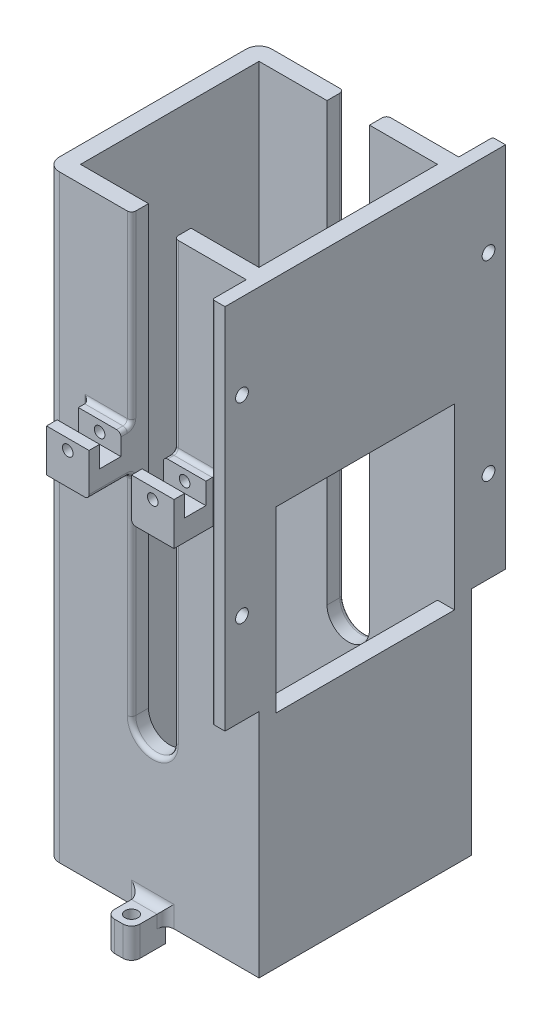
from build123d import *

# Parameters (mm, degrees)
SKETCH1_W                = 50
SKETCH1_H                = 50
SKETCH1_W_2              = 42
SKETCH1_H_2              = 42
BOSS_EXTRUDE1_DEPTH      = 140.8
CUT_EXTRUDE1_DEPTH       = 152.491385894
SKETCH5_W                = 10
SKETCH5_H                = 10
BOSS_EXTRUDE3_DEPTH      = 15
SKETCH8_W                = 10
SKETCH8_H                = 10
CUT_EXTRUDE4_DEPTH       = 107.56570743
SKETCH9_W                = 30
SKETCH9_H                = 5
CUT_EXTRUDE5_DEPTH       = 5
SKETCH10_R               = 1.25
CUT_EXTRUDE6_DEPTH       = 10
FILLET5_R                = 1
FILLET6_R                = 1
CUT_EXTRUDE3_REACH       = 155.459
SKETCH7_W                = 42
SKETCH7_H                = 42
SKETCH11_W               = 3
SKETCH11_H               = 86.5
BOSS_EXTRUDE4_DEPTH      = 8
CUT_EXTRUDE11_REACH      = 154.508
SKETCH16_R               = 1.5
FILLET3_R                = 3
FILLET4_R                = 0.5
BOSS_EXTRUDE6_DEPTH      = 4
BOSS_EXTRUDE6_DEPTH_BACK = 3
SKETCH18_W               = 6
SKETCH18_H               = 8
SKETCH18_R               = 1.5
SKETCH18_W_2             = 8
SKETCH18_H_2             = 6
FILLET7_R                = 2


with BuildPart() as part:
    # Sketch1 → Boss-Extrude1 (new body)
    with BuildSketch(Plane(origin=(0, 0, 0), x_dir=(1, 0, 0), z_dir=(0, 1, 0))):
        Rectangle(SKETCH1_W, SKETCH1_H)
        Rectangle(SKETCH1_W_2, SKETCH1_H_2, mode=Mode.SUBTRACT)
    extrude(amount=BOSS_EXTRUDE1_DEPTH)

    # Sketch3 → Cut-Extrude1 (cut, through all)
    with BuildSketch(Plane(origin=(0, 0, -25), x_dir=(-1, 0, 0), z_dir=(0, 0, -1))):
        with BuildLine():
            Line((-5, 140.8), (5, 140.8))
            Line((5, 140.8), (5, 38))
            ThreePointArc((5, 38), (0, 33), (-5, 38))
            Line((-5, 38), (-5, 140.8))
        make_face()
    extrude(amount=-CUT_EXTRUDE1_DEPTH, mode=Mode.SUBTRACT)

    # Sketch5 → Boss-Extrude3 (add, symmetric)
    with BuildSketch(Plane(origin=(0, 0, 25), x_dir=(0, 0, 1), z_dir=(-1, 0, 0))):
        with Locations((5, 92.5)):
            Rectangle(SKETCH5_W, SKETCH5_H)
    boss_extrude3 = extrude(amount=BOSS_EXTRUDE3_DEPTH, both=True)

    # Sketch8 → Cut-Extrude4 (cut, through all)
    with BuildSketch(Plane(origin=(0, 97.5, 0), x_dir=(1, 0, 0), z_dir=(0, 1, 0))):
        with Locations((0, -30)):
            Rectangle(SKETCH8_W, SKETCH8_H)
    cut_extrude4 = extrude(amount=-CUT_EXTRUDE4_DEPTH, mode=Mode.SUBTRACT)

    # Sketch9 → Cut-Extrude5 (cut)
    with BuildSketch(Plane(origin=(0, 97.5, 0), x_dir=(1, 0, 0), z_dir=(0, 1, 0))):
        with Locations((0, -30)):
            Rectangle(SKETCH9_W, SKETCH9_H)
    cut_extrude5 = extrude(amount=-CUT_EXTRUDE5_DEPTH, mode=Mode.SUBTRACT)

    # Sketch10 → Cut-Extrude6 (cut)
    with BuildSketch(Plane.XY.offset(35)):
        with Locations((-10, 95)):
            Circle(SKETCH10_R)
        with Locations((10, 95)):
            Circle(SKETCH10_R)
    cut_extrude6 = extrude(amount=-CUT_EXTRUDE6_DEPTH, mode=Mode.SUBTRACT)

    # Fillet5
    fillet5_edges = [part.edges().sort_by_distance(p)[0] for p in [
        (5, 97.5, 26.25),
        (5, 119.15, 25),
        (-5, 62.75, 25),
        (0, 33, 25),
        (5, 62.75, 25),
        (-5, 119.15, 25),
        (-10, 97.5, 25),
        (-10, 87.5, 25),
        (15, 92.5, 25),
        (10, 87.5, 25),
        (10, 97.5, 25),
        (-15, 92.5, 25),
        (5, 87.5, 30),
        (-5, 87.5, 30),
        (-5, 97.5, 26.25),
    ]]
    fillet(fillet5_edges, radius=FILLET5_R)

    # Mirror7: Boss-Extrude3, Cut-Extrude4, Cut-Extrude5, Cut-Extrude6 across plane
    add(boss_extrude3.mirror(Plane.XY))
    add(cut_extrude4.mirror(Plane.XY), mode=Mode.SUBTRACT)
    add(cut_extrude5.mirror(Plane.XY), mode=Mode.SUBTRACT)
    add(cut_extrude6.mirror(Plane.XY), mode=Mode.SUBTRACT)

    # Fillet6
    fillet6_edges = [part.edges().sort_by_distance(p)[0] for p in [
        (5, 62.75, -25),
        (-5, 119.15, -25),
        (-10, 87.5, -25),
        (-10, 97.5, -25),
        (10, 97.5, -25),
        (-15, 92.5, -25),
        (10, 87.5, -25),
        (15, 92.5, -25),
        (-5, 97.5, -26.25),
        (-5, 87.5, -30),
        (5, 87.5, -30),
        (5, 97.5, -26.25),
        (5, 119.15, -25),
        (0, 33, -25),
        (-5, 62.75, -25),
    ]]
    fillet(fillet6_edges, radius=FILLET6_R)

    # Sketch7 → Cut-Extrude3 (cut, up to next)
    with BuildSketch(Plane(origin=(25, 0, 0), x_dir=(0, 0, -1), z_dir=(1, 0, 0)), mode=Mode.PRIVATE) as cut_extrude3_sk1:
        with Locations((0, 73)):
            Rectangle(SKETCH7_W, SKETCH7_H)
    cut_extrude3_tool1 = extrude(cut_extrude3_sk1.sketch, amount=-CUT_EXTRUDE3_REACH, mode=Mode.PRIVATE) & part.part
    add(cut_extrude3_tool1.solids().sort_by_distance((25, 73, 0))[0], mode=Mode.SUBTRACT)

    # Sketch11 → Boss-Extrude4 (add)
    with BuildSketch(Plane.XY.offset(25)):
        with Locations((23.5, 97.55)):
            Rectangle(SKETCH11_W, SKETCH11_H)
    boss_extrude4 = extrude(amount=BOSS_EXTRUDE4_DEPTH)

    # Sketch16 → Cut-Extrude11 (cut, up to next)
    with BuildSketch(Plane.ZY.offset(-22), mode=Mode.PRIVATE) as cut_extrude11_sk1:
        with Locations(Location((29, 120.8, 0), (0, 0, 270))):
            Circle(SKETCH16_R)
    cut_extrude11_tool1 = extrude(cut_extrude11_sk1.sketch, amount=-CUT_EXTRUDE11_REACH, mode=Mode.PRIVATE) & part.part
    # Sketch16 → Cut-Extrude11 (cut, up to next)
    with BuildSketch(Plane.ZY.offset(-22), mode=Mode.PRIVATE) as cut_extrude11_sk2:
        with Locations(Location((29, 75.8, 0), (0, 0, 270))):
            Circle(SKETCH16_R)
    cut_extrude11_tool2 = extrude(cut_extrude11_sk2.sketch, amount=-CUT_EXTRUDE11_REACH, mode=Mode.PRIVATE) & part.part
    cut_extrude11_1 = cut_extrude11_tool1.solids().sort_by_distance((22, 120.8, 29))[0]
    add(cut_extrude11_1, mode=Mode.SUBTRACT)
    cut_extrude11_2 = cut_extrude11_tool2.solids().sort_by_distance((22, 75.8, 29))[0]
    add(cut_extrude11_2, mode=Mode.SUBTRACT)
    cut_extrude11 = cut_extrude11_1 + cut_extrude11_2  # Cut-Extrude11 as one shape, for the pattern or mirror that repeats it

    # Mirror8: Boss-Extrude4, Cut-Extrude11 across plane
    add(boss_extrude4.mirror(Plane.XY))
    add(cut_extrude11.mirror(Plane.XY), mode=Mode.SUBTRACT)

    # Fillet3
    fillet3_edges = [part.edges().sort_by_distance(p)[0] for p in [
        (-25, 70.4, -25),
        (-25, 70.4, 25),
    ]]
    fillet(fillet3_edges, radius=FILLET3_R)

    # Fillet4
    fillet4_edges = [part.edges().sort_by_distance(p)[0] for p in [
        (22, 97.55, 33),
        (22, 97.55, -33),
    ]]
    fillet(fillet4_edges, radius=FILLET4_R)

    # Sketch18 → Boss-Extrude6 (add, two sides: drawn at the far end of the back side and taken through both)
    # profile 1 of 3: a face of its own
    with BuildSketch(Plane.XZ.offset(-BOSS_EXTRUDE6_DEPTH_BACK)):
        with Locations((0, 29)):
            Rectangle(SKETCH18_W, SKETCH18_H)
        with Locations(Location((0, 30, 0), (0, 0, 270))):
            Circle(SKETCH18_R, mode=Mode.SUBTRACT)
    # profile 2 of 3: a face of its own
    with BuildSketch(Plane.XZ.offset(-BOSS_EXTRUDE6_DEPTH_BACK)):
        with Locations((-29, 0)):
            Rectangle(SKETCH18_W_2, SKETCH18_H_2)
        with Locations(Location((-30, 0, 0), (0, 0, 270))):
            Circle(SKETCH18_R, mode=Mode.SUBTRACT)
    # profile 3 of 3: a face of its own
    with BuildSketch(Plane.XZ.offset(-BOSS_EXTRUDE6_DEPTH_BACK)):
        with Locations((0, -29)):
            Rectangle(SKETCH18_W, SKETCH18_H)
        with Locations(Location((0, -30, 0), (0, 0, 270))):
            Circle(SKETCH18_R, mode=Mode.SUBTRACT)
    extrude(amount=BOSS_EXTRUDE6_DEPTH + BOSS_EXTRUDE6_DEPTH_BACK)

    # Fillet7
    fillet7_edges = [part.edges().sort_by_distance(p)[0] for p in [
        (-25, 3, 0),
        (-25, 1.5, 3),
        (-25, 1.5, -3),
        (-33, -0.5, -3),
        (-33, -0.5, 3),
        (0, 3, 25),
        (3, 1.5, 25),
        (-3, 1.5, 25),
        (-3, -0.5, 33),
        (3, -0.5, 33),
        (0, 3, -25),
        (-3, 1.5, -25),
        (3, 1.5, -25),
        (3, -0.5, -33),
        (-3, -0.5, -33),
    ]]
    fillet(fillet7_edges, radius=FILLET7_R)


solid = part.part
